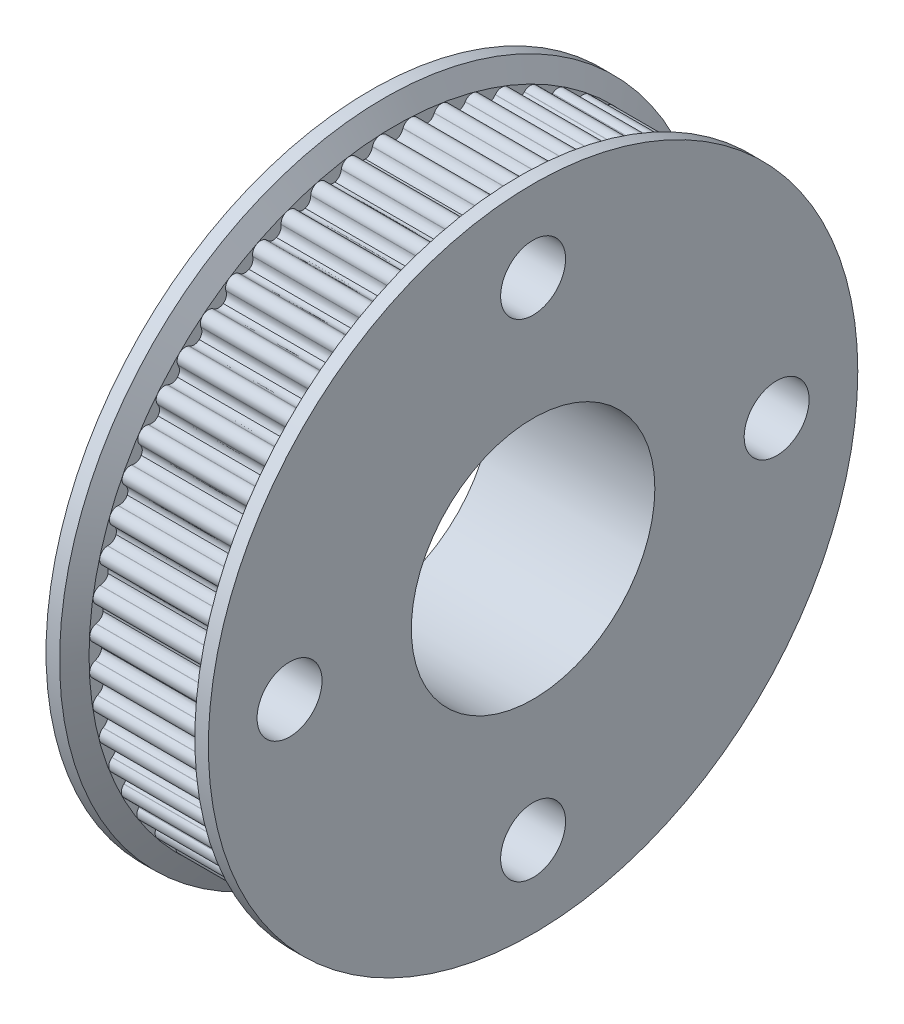
from build123d import *

# Parameters (mm, degrees)
SKETCH3_OUTSIDE_W  = 53.49
SKETCH3_OUTSIDE_H  = 53.49
CUT_EXTRUDE4_DEPTH = 7
SKETCH6_R          = 2
CUT_EXTRUDE5_DEPTH = 10
SKETCH7_R          = 3
CUT_EXTRUDE6_DEPTH = 3


with BuildPart() as part:
    # Sketch1 → Revolve1 (revolve)
    with BuildSketch(Plane(origin=(0, 0, 0), x_dir=(1, 0, 0), z_dir=(0, 1, 0))):
        Polygon((0, 7.5), (0, 8.95645673), (0, 20), (-0.83604719, 20), (-1.5, 18.85), (-8.5, 18.85), (-9.16395281, 20), (-10, 20), (-10, 7.5), align=None)
    revolve(axis=Axis((0, 0, 0), (-1, 0, 0)))

    # Sketch3 outside → Cut-Extrude4 (cut)
    with BuildSketch(Plane(origin=(-1.5, 0, 0), x_dir=(0, 0, -1), z_dir=(1, 0, 0))):
        Rectangle(SKETCH3_OUTSIDE_W, SKETCH3_OUTSIDE_H)
        with BuildLine():
            Line((0.48954913, 18.480375333), (0.485818632, 18.469717385))
            add(Edge.make_bspline(
                [(0.485818632, 18.469717385), (0.407741985, 18.249527558), (0.24028179, 18.086154527), (0.026214695, 18.085070307)],
                knots=[0, 0, 0, 0, 1, 1, 1, 1], degree=3))
            add(Edge.make_bspline(
                [(0.026214695, 18.085070307), (-0.187846082, 18.086775093), (-0.354832577, 18.250628249), (-0.432269829, 18.471041123)],
                knots=[0, 0, 0, 0, 1, 1, 1, 1], degree=3))
            Line((-0.432269829, 18.471041123), (-0.435971787, 18.481716895))
            ThreePointArc((-0.435971787, 18.481716895), (-0.931215069, 18.811965966), (-1.391421689, 18.434420969))
            Line((-1.391421689, 18.434420969), (-1.394049444, 18.423439012))
            add(Edge.make_bspline(
                [(-1.394049444, 18.423439012), (-1.451513615, 18.187532894), (-1.598236067, 18.015569009), (-1.838247448, 17.991333228)],
                knots=[0, 0, 0, 0, 1, 1, 1, 1], degree=3))
            add(Edge.make_bspline(
                [(-1.838247448, 17.991333228), (-2.078200755, 17.966529071), (-2.256668862, 18.105266918), (-2.36065454, 18.324677051)],
                knots=[0, 0, 0, 0, 1, 1, 1, 1], degree=3))
            Line((-2.36065454, 18.324677051), (-2.365448953, 18.334900655))
            ThreePointArc((-2.365448953, 18.334900655), (-2.892499669, 18.611573567), (-3.310721031, 18.187992111))
            Line((-3.310721031, 18.187992111), (-3.312186463, 18.176795639))
            add(Edge.make_bspline(
                [(-3.312186463, 18.176795639), (-3.344676936, 17.936175198), (-3.472620506, 17.749816677), (-3.70878375, 17.700625641)],
                knots=[0, 0, 0, 0, 1, 1, 1, 1], degree=3))
            add(Edge.make_bspline(
                [(-3.70878375, 17.700625641), (-3.944829828, 17.650875413), (-4.136822322, 17.770198244), (-4.26317296, 17.977536961)],
                knots=[0, 0, 0, 0, 1, 1, 1, 1], degree=3))
            Line((-4.26317296, 17.977536961), (-4.269009766, 17.987203407))
            ThreePointArc((-4.269009766, 17.987203407), (-4.822093437, 18.207268875), (-5.19374742, 17.742291806))
            Line((-5.19374742, 17.742291806), (-5.194034475, 17.73100349))
            add(Edge.make_bspline(
                [(-5.194034475, 17.73100349), (-5.201195276, 17.488305013), (-5.308958188, 17.289593639), (-5.538685842, 17.215986296)],
                knots=[0, 0, 0, 0, 1, 1, 1, 1], degree=3))
            add(Edge.make_bspline(
                [(-5.538685842, 17.215986296), (-5.76823852, 17.141835071), (-5.971651891, 17.240435558), (-6.118983164, 17.433431215)],
                knots=[0, 0, 0, 0, 1, 1, 1, 1], degree=3))
            Line((-6.118983164, 17.433431215), (-6.125798415, 17.442434594))
            ThreePointArc((-6.125798415, 17.442434594), (-6.698855341, 17.603481534), (-7.019870026, 17.102203239))
            Line((-7.019870026, 17.102203239), (-7.018975557, 17.090946756))
            add(Edge.make_bspline(
                [(-7.018975557, 17.090946756), (-7.000728232, 16.848829299), (-7.087129813, 16.639942195), (-7.307904933, 16.542725002)],
                knots=[0, 0, 0, 0, 1, 1, 1, 1], degree=3))
            add(Edge.make_bspline(
                [(-7.307904933, 16.542725002), (-7.528449183, 16.444985197), (-7.741054792, 16.521783053), (-7.907752509, 16.698321148)],
                knots=[0, 0, 0, 0, 1, 1, 1, 1], degree=3))
            Line((-7.907752509, 16.698321148), (-7.915471534, 16.706562818))
            ThreePointArc((-7.915471534, 16.706562818), (-8.502223183, 16.806826766), (-8.769081466, 16.274739354))
            Line((-8.769081466, 16.274739354), (-8.767015275, 16.263638033))
            add(Edge.make_bspline(
                [(-8.767015275, 16.263638033), (-8.723559745, 16.024754286), (-8.787653361, 15.807980062), (-8.997057087, 15.688218151)],
                knots=[0, 0, 0, 0, 1, 1, 1, 1], degree=3))
            add(Edge.make_bspline(
                [(-8.997057087, 15.688218151), (-9.206176582, 15.567960623), (-9.425645077, 15.622114435), (-9.609882862, 15.78026078)],
                knots=[0, 0, 0, 0, 1, 1, 1, 1], degree=3))
            Line((-9.609882862, 15.78026078), (-9.61842109, 15.787650443))
            ThreePointArc((-9.61842109, 15.787650443), (-10.212438889, 15.826032887), (-10.422217015, 15.268966019))
            Line((-10.422217015, 15.268966019), (-10.419001739, 15.258141488))
            add(Edge.make_bspline(
                [(-10.419001739, 15.258141488), (-10.350814112, 15.025108711), (-10.391897539, 14.802822392), (-10.587635602, 14.6618279)],
                knots=[0, 0, 0, 0, 1, 1, 1, 1], degree=3))
            add(Edge.make_bspline(
                [(-10.587635602, 14.6618279), (-10.783039184, 14.520370216), (-11.006966022, 14.551286663), (-11.206725327, 14.689308572)],
                knots=[0, 0, 0, 0, 1, 1, 1, 1], degree=3))
            Line((-11.206725327, 14.689308572), (-11.215989213, 14.695765267))
            ThreePointArc((-11.215989213, 14.695765267), (-11.810764978, 14.671845679), (-11.961164573, 14.095902697))
            Line((-11.961164573, 14.095902697), (-11.956835439, 14.085473551))
            add(Edge.make_bspline(
                [(-11.956835439, 14.085473551), (-11.864662793, 13.8608449), (-11.882285914, 13.635481902), (-12.062213765, 13.474799593)],
                knots=[0, 0, 0, 0, 1, 1, 1, 1], degree=3))
            add(Edge.make_bspline(
                [(-12.062213765, 13.474799593), (-12.241760551, 13.313691593), (-12.467692344, 13.321031948), (-12.680784565, 13.437417226)],
                knots=[0, 0, 0, 0, 1, 1, 1, 1], degree=3))
            Line((-12.680784565, 13.437417226), (-12.69067261, 13.442870211))
            ThreePointArc((-12.69067261, 13.442870211), (-13.279689854, 13.356910661), (-13.36906311, 12.768401715))
            Line((-13.36906311, 12.768401715), (-13.363667548, 12.75848222))
            add(Edge.make_bspline(
                [(-13.363667548, 12.75848222), (-13.248519746, 12.544718773), (-13.242489477, 12.318748218), (-13.404635791, 12.140138563)],
                knots=[0, 0, 0, 0, 1, 1, 1, 1], degree=3))
            add(Edge.make_bspline(
                [(-13.404635791, 12.140138563), (-13.566358629, 11.961145379), (-13.791820019, 11.94482922), (-14.015910473, 12.038302725)],
                knots=[0, 0, 0, 0, 1, 1, 1, 1], degree=3))
            Line((-14.015910473, 12.038302725), (-14.026314343, 12.042692255))
            ThreePointArc((-14.026314343, 12.042692255), (-14.603119668, 11.895634533), (-14.630487393, 11.301007453))
            Line((-14.630487393, 11.301007453), (-14.624084519, 11.291706287))
            add(Edge.make_bspline(
                [(-14.624084519, 11.291706287), (-14.487223144, 11.091150081), (-14.457605555, 10.867047752), (-14.600193821, 10.672467633)],
                knots=[0, 0, 0, 0, 1, 1, 1, 1], degree=3))
            add(Edge.make_bspline(
                [(-14.600193821, 10.672467633), (-14.742320842, 10.477550354), (-14.964841628, 10.437756444), (-15.197475133, 10.50729406)],
                knots=[0, 0, 0, 0, 1, 1, 1, 1], degree=3))
            Line((-15.197475133, 10.50729406), (-15.20828084, 10.510572043))
            ThreePointArc((-15.20828084, 10.510572043), (-15.766554648, 10.304027345), (-15.731616994, 9.709796987))
            Line((-15.731616994, 9.709796987), (-15.72427696, 9.701216057))
            add(Edge.make_bspline(
                [(-15.72427696, 9.701216057), (-15.567201494, 9.516064428), (-15.514321081, 9.296285636), (-15.635789073, 9.087866916)],
                knots=[0, 0, 0, 0, 1, 1, 1, 1], degree=3))
            add(Edge.make_bspline(
                [(-15.635789073, 9.087866916), (-15.756763103, 8.879161094), (-15.973905301, 8.816325423), (-16.212533075, 8.861165283)],
                knots=[0, 0, 0, 0, 1, 1, 1, 1], degree=3))
            Line((-16.212533075, 8.861165283), (-16.22362223, 8.863295805))
            ThreePointArc((-16.22362223, 8.863295805), (-16.757247956, 8.599527076), (-16.660387708, 8.012203954))
            Line((-16.660387708, 8.012203954), (-16.652190932, 8.004437273))
            add(Edge.make_bspline(
                [(-16.652190932, 8.004437273), (-16.476622326, 7.836718782), (-16.401058458, 7.623671469), (-16.500075347, 7.403697626)],
                knots=[0, 0, 0, 0, 1, 1, 1, 1], degree=3))
            add(Edge.make_bspline(
                [(-16.500075347, 7.403697626), (-16.598570971, 7.183489887), (-16.807955525, 7.098300897), (-17.049963113, 7.117951724)],
                knots=[0, 0, 0, 0, 1, 1, 1, 1], degree=3))
            Line((-17.049963113, 7.117951724), (-17.06121422, 7.118911443))
            ThreePointArc((-17.06121422, 7.118911443), (-17.564345349, 6.80080859), (-17.406623728, 6.226827538))
            Line((-17.406623728, 6.226827538), (-17.397660015, 6.2199602))
            add(Edge.make_bspline(
                [(-17.397660015, 6.2199602), (-17.205521836, 6.071512405), (-17.108102407, 5.867530763), (-17.183583343, 5.638411876)],
                knots=[0, 0, 0, 0, 1, 1, 1, 1], degree=3))
            add(Edge.make_bspline(
                [(-17.183583343, 5.638411876), (-17.258521421, 5.409114862), (-17.45785427, 5.3025059), (-17.700590186, 5.296752397)],
                knots=[0, 0, 0, 0, 1, 1, 1, 1], degree=3))
            Line((-17.700590186, 5.296752397), (-17.711879977, 5.296530797))
            ThreePointArc((-17.711879977, 5.296530797), (-18.179004098, 4.927579021), (-17.962149135, 4.373228696))
            Line((-17.962149135, 4.373228696), (-17.952516694, 4.367335942))
            add(Edge.make_bspline(
                [(-17.952516694, 4.367335942), (-17.745914049, 4.239785268), (-17.627706406, 4.047104161), (-17.678824405, 3.811350505)],
                knots=[0, 0, 0, 0, 1, 1, 1, 1], degree=3))
            add(Edge.make_bspline(
                [(-17.678824405, 3.811350505), (-17.729383899, 3.575476442), (-17.916481111, 3.448615539), (-18.157285889, 3.417520742)],
                knots=[0, 0, 0, 0, 1, 1, 1, 1], degree=3))
            Line((-18.157285889, 3.417520742), (-18.16849067, 3.416120252))
            ThreePointArc((-18.16849067, 3.416120252), (-18.594489874, 3.000361866), (-18.320877478, 2.471715846))
            Line((-18.320877478, 2.471715846), (-18.310681844, 2.466862237))
            add(Edge.make_bspline(
                [(-18.310681844, 2.466862237), (-18.091878313, 2.361606156), (-17.954177565, 2.18233664), (-17.980372566, 1.942531181)],
                knots=[0, 0, 0, 0, 1, 1, 1, 1], degree=3))
            add(Edge.make_bspline(
                [(-17.980372566, 1.942531181), (-18.005999537, 1.702664355), (-18.178811236, 1.556941425), (-18.415046569, 1.500846015)],
                knots=[0, 0, 0, 0, 1, 1, 1, 1], degree=3))
            Line((-18.415046569, 1.500846015), (-18.426043577, 1.498281978))
            ThreePointArc((-18.426043577, 1.498281978), (-18.806250528, 1.040272118), (-18.478878453, 0.543122359))
            Line((-18.478878453, 0.543122359), (-18.468231332, 0.539361073))
            add(Edge.make_bspline(
                [(-18.468231332, 0.539361073), (-18.239624173, 0.457552792), (-18.083938997, 0.293658981), (-18.084924003, 0.052429079)],
                knots=[0, 0, 0, 0, 1, 1, 1, 1], degree=3))
            add(Edge.make_bspline(
                [(-18.084924003, 0.052429079), (-18.085337676, -0.18880248), (-18.2419705, -0.351790866), (-18.471048144, -0.432272296)],
                knots=[0, 0, 0, 0, 1, 1, 1, 1], degree=3))
            Line((-18.471048144, -0.432272296), (-18.481716895, -0.435971787))
            ThreePointArc((-18.481716895, -0.435971787), (-18.811965966, -0.931215069), (-18.434420969, -1.391421689))
            Line((-18.434420969, -1.391421689), (-18.423439012, -1.394049444))
            add(Edge.make_bspline(
                [(-18.423439012, -1.394049444), (-18.187532894, -1.451513615), (-18.015569009, -1.598236067), (-17.991333228, -1.838247448)],
                knots=[0, 0, 0, 0, 1, 1, 1, 1], degree=3))
            add(Edge.make_bspline(
                [(-17.991333228, -1.838247448), (-17.966529071, -2.078200755), (-18.105266918, -2.256668862), (-18.324677051, -2.36065454)],
                knots=[0, 0, 0, 0, 1, 1, 1, 1], degree=3))
            Line((-18.324677051, -2.36065454), (-18.334900655, -2.365448953))
            ThreePointArc((-18.334900655, -2.365448953), (-18.611573568, -2.892499669), (-18.187992112, -3.310721031))
            Line((-18.187992112, -3.310721031), (-18.17679564, -3.312186463))
            add(Edge.make_bspline(
                [(-18.17679564, -3.312186463), (-17.936175198, -3.344676936), (-17.749816677, -3.472620506), (-17.700625641, -3.70878375)],
                knots=[0, 0, 0, 0, 1, 1, 1, 1], degree=3))
            add(Edge.make_bspline(
                [(-17.700625641, -3.70878375), (-17.650875413, -3.944829828), (-17.770198244, -4.136822322), (-17.977536961, -4.26317296)],
                knots=[0, 0, 0, 0, 1, 1, 1, 1], degree=3))
            Line((-17.977536961, -4.26317296), (-17.987203407, -4.269009766))
            ThreePointArc((-17.987203407, -4.269009766), (-18.207268875, -4.822093437), (-17.742291806, -5.19374742))
            Line((-17.742291806, -5.19374742), (-17.73100349, -5.194034475))
            add(Edge.make_bspline(
                [(-17.73100349, -5.194034475), (-17.488305014, -5.201195276), (-17.289593639, -5.308958188), (-17.215986296, -5.538685842)],
                knots=[0, 0, 0, 0, 1, 1, 1, 1], degree=3))
            add(Edge.make_bspline(
                [(-17.215986296, -5.538685842), (-17.141835071, -5.76823852), (-17.240435558, -5.971651891), (-17.433431215, -6.118983164)],
                knots=[0, 0, 0, 0, 1, 1, 1, 1], degree=3))
            Line((-17.433431215, -6.118983164), (-17.442434594, -6.125798415))
            ThreePointArc((-17.442434594, -6.125798415), (-17.603481534, -6.698855341), (-17.102203239, -7.019870026))
            Line((-17.102203239, -7.019870026), (-17.090946756, -7.018975557))
            add(Edge.make_bspline(
                [(-17.090946756, -7.018975557), (-16.848829299, -7.000728232), (-16.639942195, -7.087129813), (-16.542725002, -7.307904933)],
                knots=[0, 0, 0, 0, 1, 1, 1, 1], degree=3))
            add(Edge.make_bspline(
                [(-16.542725002, -7.307904933), (-16.444985197, -7.528449183), (-16.521783053, -7.741054792), (-16.698321148, -7.907752509)],
                knots=[0, 0, 0, 0, 1, 1, 1, 1], degree=3))
            Line((-16.698321148, -7.907752509), (-16.706562818, -7.915471534))
            ThreePointArc((-16.706562818, -7.915471534), (-16.806826766, -8.502223183), (-16.274739354, -8.769081466))
            Line((-16.274739354, -8.769081466), (-16.263638033, -8.767015275))
            add(Edge.make_bspline(
                [(-16.263638033, -8.767015275), (-16.024754286, -8.723559745), (-15.807980062, -8.787653361), (-15.688218151, -8.997057087)],
                knots=[0, 0, 0, 0, 1, 1, 1, 1], degree=3))
            add(Edge.make_bspline(
                [(-15.688218151, -8.997057087), (-15.567960623, -9.206176582), (-15.622114435, -9.425645077), (-15.78026078, -9.609882862)],
                knots=[0, 0, 0, 0, 1, 1, 1, 1], degree=3))
            Line((-15.78026078, -9.609882862), (-15.787650443, -9.61842109))
            ThreePointArc((-15.787650443, -9.61842109), (-15.826032887, -10.212438889), (-15.268966019, -10.422217015))
            Line((-15.268966019, -10.422217015), (-15.258141488, -10.419001739))
            add(Edge.make_bspline(
                [(-15.258141488, -10.419001739), (-15.025108711, -10.350814112), (-14.802822392, -10.391897539), (-14.6618279, -10.587635602)],
                knots=[0, 0, 0, 0, 1, 1, 1, 1], degree=3))
            add(Edge.make_bspline(
                [(-14.6618279, -10.587635602), (-14.520370216, -10.783039184), (-14.551286663, -11.006966022), (-14.689308572, -11.206725327)],
                knots=[0, 0, 0, 0, 1, 1, 1, 1], degree=3))
            Line((-14.689308572, -11.206725327), (-14.695765267, -11.215989213))
            ThreePointArc((-14.695765267, -11.215989213), (-14.671845679, -11.810764978), (-14.095902697, -11.961164573))
            Line((-14.095902697, -11.961164573), (-14.085473552, -11.956835439))
            add(Edge.make_bspline(
                [(-14.085473552, -11.956835439), (-13.8608449, -11.864662793), (-13.635481902, -11.882285914), (-13.474799593, -12.062213765)],
                knots=[0, 0, 0, 0, 1, 1, 1, 1], degree=3))
            add(Edge.make_bspline(
                [(-13.474799593, -12.062213765), (-13.313691593, -12.241760551), (-13.321031948, -12.467692344), (-13.437417226, -12.680784565)],
                knots=[0, 0, 0, 0, 1, 1, 1, 1], degree=3))
            Line((-13.437417226, -12.680784565), (-13.442870211, -12.69067261))
            ThreePointArc((-13.442870211, -12.69067261), (-13.356910661, -13.279689854), (-12.768401715, -13.36906311))
            Line((-12.768401715, -13.36906311), (-12.75848222, -13.363667548))
            add(Edge.make_bspline(
                [(-12.75848222, -13.363667548), (-12.544718773, -13.248519746), (-12.318748218, -13.242489477), (-12.140138563, -13.404635791)],
                knots=[0, 0, 0, 0, 1, 1, 1, 1], degree=3))
            add(Edge.make_bspline(
                [(-12.140138563, -13.404635791), (-11.961145379, -13.566358629), (-11.94482922, -13.791820019), (-12.038302725, -14.015910473)],
                knots=[0, 0, 0, 0, 1, 1, 1, 1], degree=3))
            Line((-12.038302725, -14.015910473), (-12.042692255, -14.026314343))
            ThreePointArc((-12.042692255, -14.026314343), (-11.895634533, -14.603119668), (-11.301007453, -14.630487393))
            Line((-11.301007453, -14.630487393), (-11.291706287, -14.624084519))
            add(Edge.make_bspline(
                [(-11.291706287, -14.624084519), (-11.091150081, -14.487223144), (-10.867047752, -14.457605555), (-10.672467633, -14.600193821)],
                knots=[0, 0, 0, 0, 1, 1, 1, 1], degree=3))
            add(Edge.make_bspline(
                [(-10.672467633, -14.600193821), (-10.477550354, -14.742320842), (-10.437756444, -14.964841628), (-10.50729406, -15.197475133)],
                knots=[0, 0, 0, 0, 1, 1, 1, 1], degree=3))
            Line((-10.50729406, -15.197475133), (-10.510572044, -15.20828084))
            ThreePointArc((-10.510572044, -15.20828084), (-10.304027345, -15.766554648), (-9.709796987, -15.731616994))
            Line((-9.709796987, -15.731616994), (-9.701216057, -15.72427696))
            add(Edge.make_bspline(
                [(-9.701216057, -15.72427696), (-9.516064428, -15.567201494), (-9.296285636, -15.514321081), (-9.087866916, -15.635789073)],
                knots=[0, 0, 0, 0, 1, 1, 1, 1], degree=3))
            add(Edge.make_bspline(
                [(-9.087866916, -15.635789073), (-8.879161094, -15.756763103), (-8.816325423, -15.973905301), (-8.861165283, -16.212533075)],
                knots=[0, 0, 0, 0, 1, 1, 1, 1], degree=3))
            Line((-8.861165283, -16.212533075), (-8.863295805, -16.22362223))
            ThreePointArc((-8.863295805, -16.22362223), (-8.599527076, -16.757247956), (-8.012203954, -16.660387708))
            Line((-8.012203954, -16.660387708), (-8.004437273, -16.652190932))
            add(Edge.make_bspline(
                [(-8.004437273, -16.652190932), (-7.836718782, -16.476622326), (-7.623671469, -16.401058458), (-7.403697626, -16.500075347)],
                knots=[0, 0, 0, 0, 1, 1, 1, 1], degree=3))
            add(Edge.make_bspline(
                [(-7.403697626, -16.500075347), (-7.183489887, -16.598570971), (-7.098300897, -16.807955525), (-7.117951724, -17.049963113)],
                knots=[0, 0, 0, 0, 1, 1, 1, 1], degree=3))
            Line((-7.117951724, -17.049963113), (-7.118911443, -17.06121422))
            ThreePointArc((-7.118911443, -17.06121422), (-6.80080859, -17.564345349), (-6.226827538, -17.406623728))
            Line((-6.226827538, -17.406623728), (-6.2199602, -17.397660015))
            add(Edge.make_bspline(
                [(-6.2199602, -17.397660015), (-6.071512405, -17.205521836), (-5.867530763, -17.108102407), (-5.638411876, -17.183583343)],
                knots=[0, 0, 0, 0, 1, 1, 1, 1], degree=3))
            add(Edge.make_bspline(
                [(-5.638411876, -17.183583343), (-5.409114862, -17.258521421), (-5.3025059, -17.45785427), (-5.296752397, -17.700590186)],
                knots=[0, 0, 0, 0, 1, 1, 1, 1], degree=3))
            Line((-5.296752397, -17.700590186), (-5.296530797, -17.711879977))
            ThreePointArc((-5.296530797, -17.711879977), (-4.927579021, -18.179004098), (-4.373228696, -17.962149135))
            Line((-4.373228696, -17.962149135), (-4.367335942, -17.952516694))
            add(Edge.make_bspline(
                [(-4.367335942, -17.952516694), (-4.239785268, -17.745914049), (-4.047104161, -17.627706406), (-3.811350505, -17.678824405)],
                knots=[0, 0, 0, 0, 1, 1, 1, 1], degree=3))
            add(Edge.make_bspline(
                [(-3.811350505, -17.678824405), (-3.575476442, -17.729383899), (-3.448615539, -17.916481111), (-3.417520742, -18.157285889)],
                knots=[0, 0, 0, 0, 1, 1, 1, 1], degree=3))
            Line((-3.417520742, -18.157285889), (-3.416120252, -18.16849067))
            ThreePointArc((-3.416120252, -18.16849067), (-3.000361866, -18.594489874), (-2.471715846, -18.320877478))
            Line((-2.471715846, -18.320877478), (-2.466862237, -18.310681844))
            add(Edge.make_bspline(
                [(-2.466862237, -18.310681844), (-2.361606156, -18.091878314), (-2.18233664, -17.954177565), (-1.942531181, -17.980372566)],
                knots=[0, 0, 0, 0, 1, 1, 1, 1], degree=3))
            add(Edge.make_bspline(
                [(-1.942531181, -17.980372566), (-1.702664355, -18.005999537), (-1.556941425, -18.178811236), (-1.500846015, -18.415046569)],
                knots=[0, 0, 0, 0, 1, 1, 1, 1], degree=3))
            Line((-1.500846015, -18.415046569), (-1.498281978, -18.426043577))
            ThreePointArc((-1.498281978, -18.426043577), (-1.040272118, -18.806250528), (-0.543122359, -18.478878453))
            Line((-0.543122359, -18.478878453), (-0.539361073, -18.468231332))
            add(Edge.make_bspline(
                [(-0.539361073, -18.468231332), (-0.457552792, -18.239624173), (-0.293658981, -18.083938997), (-0.052429079, -18.084924003)],
                knots=[0, 0, 0, 0, 1, 1, 1, 1], degree=3))
            add(Edge.make_bspline(
                [(-0.052429079, -18.084924003), (0.18880248, -18.085337676), (0.351790866, -18.2419705), (0.432272296, -18.471048144)],
                knots=[0, 0, 0, 0, 1, 1, 1, 1], degree=3))
            Line((0.432272296, -18.471048144), (0.435971787, -18.481716895))
            ThreePointArc((0.435971787, -18.481716895), (0.931215069, -18.811965966), (1.391421689, -18.434420969))
            Line((1.391421689, -18.434420969), (1.39404954, -18.423439036))
            add(Edge.make_bspline(
                [(1.39404954, -18.423439036), (1.451513615, -18.187532894), (1.598236067, -18.015569009), (1.838247448, -17.991333228)],
                knots=[0, 0, 0, 0, 1, 1, 1, 1], degree=3))
            add(Edge.make_bspline(
                [(1.838247448, -17.991333228), (2.078200755, -17.966529071), (2.256668862, -18.105266919), (2.36065454, -18.324677051)],
                knots=[0, 0, 0, 0, 1, 1, 1, 1], degree=3))
            Line((2.36065454, -18.324677051), (2.365448953, -18.334900655))
            ThreePointArc((2.365448953, -18.334900655), (2.892499669, -18.611573568), (3.310721031, -18.187992112))
            Line((3.310721031, -18.187992112), (3.312186562, -18.176795653))
            add(Edge.make_bspline(
                [(3.312186562, -18.176795653), (3.344676936, -17.936175198), (3.472620506, -17.749816677), (3.70878375, -17.700625641)],
                knots=[0, 0, 0, 0, 1, 1, 1, 1], degree=3))
            add(Edge.make_bspline(
                [(3.70878375, -17.700625641), (3.944829828, -17.650875413), (4.136822322, -17.770198244), (4.26317296, -17.977536961)],
                knots=[0, 0, 0, 0, 1, 1, 1, 1], degree=3))
            Line((4.26317296, -17.977536961), (4.269009766, -17.987203407))
            ThreePointArc((4.269009766, -17.987203407), (4.822093437, -18.207268875), (5.19374742, -17.742291806))
            Line((5.19374742, -17.742291806), (5.194034574, -17.731003493))
            add(Edge.make_bspline(
                [(5.194034574, -17.731003493), (5.201195276, -17.488305014), (5.308958188, -17.289593639), (5.538685842, -17.215986296)],
                knots=[0, 0, 0, 0, 1, 1, 1, 1], degree=3))
            add(Edge.make_bspline(
                [(5.538685842, -17.215986296), (5.76823852, -17.141835071), (5.971651891, -17.240435558), (6.118983164, -17.433431215)],
                knots=[0, 0, 0, 0, 1, 1, 1, 1], degree=3))
            Line((6.118983164, -17.433431215), (6.125798414, -17.442434594))
            ThreePointArc((6.125798414, -17.442434594), (6.698855341, -17.603481534), (7.019870025, -17.102203239))
            Line((7.019870025, -17.102203239), (7.018975656, -17.090946748))
            add(Edge.make_bspline(
                [(7.018975656, -17.090946748), (7.000728232, -16.848829299), (7.087129813, -16.639942195), (7.307904932, -16.542725002)],
                knots=[0, 0, 0, 0, 1, 1, 1, 1], degree=3))
            add(Edge.make_bspline(
                [(7.307904932, -16.542725002), (7.528449183, -16.444985197), (7.741054792, -16.521783053), (7.907752509, -16.698321148)],
                knots=[0, 0, 0, 0, 1, 1, 1, 1], degree=3))
            Line((7.907752509, -16.698321148), (7.915471534, -16.706562818))
            ThreePointArc((7.915471534, -16.706562818), (8.502223183, -16.806826766), (8.769081466, -16.274739354))
            Line((8.769081466, -16.274739354), (8.767015373, -16.263638015))
            add(Edge.make_bspline(
                [(8.767015373, -16.263638015), (8.723559745, -16.024754286), (8.787653361, -15.807980062), (8.997057087, -15.688218151)],
                knots=[0, 0, 0, 0, 1, 1, 1, 1], degree=3))
            add(Edge.make_bspline(
                [(8.997057087, -15.688218151), (9.206176582, -15.567960623), (9.425645077, -15.622114435), (9.609882862, -15.78026078)],
                knots=[0, 0, 0, 0, 1, 1, 1, 1], degree=3))
            Line((9.609882862, -15.78026078), (9.61842109, -15.787650443))
            ThreePointArc((9.61842109, -15.787650443), (10.212438889, -15.826032887), (10.422217015, -15.268966019))
            Line((10.422217015, -15.268966019), (10.419001834, -15.25814146))
            add(Edge.make_bspline(
                [(10.419001834, -15.25814146), (10.350814112, -15.025108711), (10.391897539, -14.802822392), (10.587635602, -14.6618279)],
                knots=[0, 0, 0, 0, 1, 1, 1, 1], degree=3))
            add(Edge.make_bspline(
                [(10.587635602, -14.6618279), (10.783039184, -14.520370216), (11.006966022, -14.551286663), (11.206725327, -14.689308572)],
                knots=[0, 0, 0, 0, 1, 1, 1, 1], degree=3))
            Line((11.206725327, -14.689308572), (11.215989213, -14.695765267))
            ThreePointArc((11.215989213, -14.695765267), (11.810764978, -14.671845679), (11.961164573, -14.095902697))
            Line((11.961164573, -14.095902697), (11.956835531, -14.085473514))
            add(Edge.make_bspline(
                [(11.956835531, -14.085473514), (11.864662793, -13.8608449), (11.882285914, -13.635481902), (12.062213765, -13.474799593)],
                knots=[0, 0, 0, 0, 1, 1, 1, 1], degree=3))
            add(Edge.make_bspline(
                [(12.062213765, -13.474799593), (12.241760551, -13.313691593), (12.467692344, -13.321031948), (12.680784565, -13.437417226)],
                knots=[0, 0, 0, 0, 1, 1, 1, 1], degree=3))
            Line((12.680784565, -13.437417226), (12.69067261, -13.442870211))
            ThreePointArc((12.69067261, -13.442870211), (13.279689854, -13.356910661), (13.36906311, -12.768401715))
            Line((13.36906311, -12.768401715), (13.363667635, -12.758482173))
            add(Edge.make_bspline(
                [(13.363667635, -12.758482173), (13.248519746, -12.544718773), (13.242489477, -12.318748218), (13.404635791, -12.140138563)],
                knots=[0, 0, 0, 0, 1, 1, 1, 1], degree=3))
            add(Edge.make_bspline(
                [(13.404635791, -12.140138563), (13.566358629, -11.961145379), (13.791820019, -11.94482922), (14.015910473, -12.038302725)],
                knots=[0, 0, 0, 0, 1, 1, 1, 1], degree=3))
            Line((14.015910473, -12.038302725), (14.026314343, -12.042692255))
            ThreePointArc((14.026314343, -12.042692255), (14.603119668, -11.895634533), (14.630487393, -11.301007453))
            Line((14.630487393, -11.301007453), (14.624084601, -11.291706231))
            add(Edge.make_bspline(
                [(14.624084601, -11.291706231), (14.487223144, -11.091150081), (14.457605555, -10.867047752), (14.600193821, -10.672467633)],
                knots=[0, 0, 0, 0, 1, 1, 1, 1], degree=3))
            add(Edge.make_bspline(
                [(14.600193821, -10.672467633), (14.742320842, -10.477550354), (14.964841628, -10.437756444), (15.197475133, -10.50729406)],
                knots=[0, 0, 0, 0, 1, 1, 1, 1], degree=3))
            Line((15.197475133, -10.50729406), (15.20828084, -10.510572044))
            ThreePointArc((15.20828084, -10.510572044), (15.766554648, -10.304027345), (15.731616994, -9.709796987))
            Line((15.731616994, -9.709796987), (15.724277035, -9.701215992))
            add(Edge.make_bspline(
                [(15.724277035, -9.701215992), (15.567201493, -9.516064428), (15.514321081, -9.296285636), (15.635789073, -9.087866916)],
                knots=[0, 0, 0, 0, 1, 1, 1, 1], degree=3))
            add(Edge.make_bspline(
                [(15.635789073, -9.087866916), (15.756763103, -8.879161094), (15.973905301, -8.816325423), (16.212533075, -8.861165283)],
                knots=[0, 0, 0, 0, 1, 1, 1, 1], degree=3))
            Line((16.212533075, -8.861165283), (16.22362223, -8.863295805))
            ThreePointArc((16.22362223, -8.863295805), (16.757247956, -8.599527077), (16.660387708, -8.012203954))
            Line((16.660387708, -8.012203954), (16.652191, -8.004437202))
            add(Edge.make_bspline(
                [(16.652191, -8.004437202), (16.476622326, -7.836718782), (16.401058458, -7.623671469), (16.500075347, -7.403697626)],
                knots=[0, 0, 0, 0, 1, 1, 1, 1], degree=3))
            add(Edge.make_bspline(
                [(16.500075347, -7.403697626), (16.598570971, -7.183489887), (16.807955525, -7.098300897), (17.049963113, -7.117951724)],
                knots=[0, 0, 0, 0, 1, 1, 1, 1], degree=3))
            Line((17.049963113, -7.117951724), (17.06121422, -7.118911443))
            ThreePointArc((17.06121422, -7.118911443), (17.564345349, -6.80080859), (17.406623728, -6.226827538))
            Line((17.406623728, -6.226827538), (17.397660075, -6.219960122))
            add(Edge.make_bspline(
                [(17.397660075, -6.219960122), (17.205521836, -6.071512405), (17.108102407, -5.867530763), (17.183583343, -5.638411876)],
                knots=[0, 0, 0, 0, 1, 1, 1, 1], degree=3))
            add(Edge.make_bspline(
                [(17.183583343, -5.638411876), (17.258521421, -5.409114862), (17.45785427, -5.3025059), (17.700590186, -5.296752397)],
                knots=[0, 0, 0, 0, 1, 1, 1, 1], degree=3))
            Line((17.700590186, -5.296752397), (17.711879977, -5.296530797))
            ThreePointArc((17.711879977, -5.296530797), (18.179004098, -4.927579021), (17.962149135, -4.373228696))
            Line((17.962149135, -4.373228696), (17.952516746, -4.367335857))
            add(Edge.make_bspline(
                [(17.952516746, -4.367335857), (17.745914049, -4.239785268), (17.627706406, -4.047104161), (17.678824404, -3.811350505)],
                knots=[0, 0, 0, 0, 1, 1, 1, 1], degree=3))
            add(Edge.make_bspline(
                [(17.678824404, -3.811350505), (17.729383899, -3.575476442), (17.916481111, -3.448615539), (18.157285889, -3.417520742)],
                knots=[0, 0, 0, 0, 1, 1, 1, 1], degree=3))
            Line((18.157285889, -3.417520742), (18.16849067, -3.416120252))
            ThreePointArc((18.16849067, -3.416120252), (18.594489874, -3.000361866), (18.320877478, -2.471715846))
            Line((18.320877478, -2.471715846), (18.310681887, -2.466862147))
            add(Edge.make_bspline(
                [(18.310681887, -2.466862147), (18.091878313, -2.361606156), (17.954177565, -2.18233664), (17.980372566, -1.942531181)],
                knots=[0, 0, 0, 0, 1, 1, 1, 1], degree=3))
            add(Edge.make_bspline(
                [(17.980372566, -1.942531181), (18.005999537, -1.702664355), (18.178811236, -1.556941425), (18.415046569, -1.500846015)],
                knots=[0, 0, 0, 0, 1, 1, 1, 1], degree=3))
            Line((18.415046569, -1.500846015), (18.426043577, -1.498281978))
            ThreePointArc((18.426043577, -1.498281978), (18.806250528, -1.040272118), (18.478878453, -0.543122359))
            Line((18.478878453, -0.543122359), (18.468231365, -0.539360979))
            add(Edge.make_bspline(
                [(18.468231365, -0.539360979), (18.239624173, -0.457552792), (18.083938997, -0.293658981), (18.084924003, -0.052429079)],
                knots=[0, 0, 0, 0, 1, 1, 1, 1], degree=3))
            add(Edge.make_bspline(
                [(18.084924003, -0.052429079), (18.085337676, 0.18880248), (18.2419705, 0.351790866), (18.471048144, 0.432272296)],
                knots=[0, 0, 0, 0, 1, 1, 1, 1], degree=3))
            Line((18.471048144, 0.432272296), (18.481716895, 0.435971787))
            ThreePointArc((18.481716895, 0.435971787), (18.811965966, 0.931215069), (18.434420969, 1.391421689))
            Line((18.434420969, 1.391421689), (18.423439036, 1.39404954))
            add(Edge.make_bspline(
                [(18.423439036, 1.39404954), (18.187532894, 1.451513615), (18.015569009, 1.598236067), (17.991333228, 1.838247448)],
                knots=[0, 0, 0, 0, 1, 1, 1, 1], degree=3))
            add(Edge.make_bspline(
                [(17.991333228, 1.838247448), (17.966529071, 2.078200755), (18.105266919, 2.256668862), (18.324677051, 2.36065454)],
                knots=[0, 0, 0, 0, 1, 1, 1, 1], degree=3))
            Line((18.324677051, 2.36065454), (18.334900655, 2.365448953))
            ThreePointArc((18.334900655, 2.365448953), (18.611573568, 2.892499669), (18.187992112, 3.310721031))
            Line((18.187992112, 3.310721031), (18.176795653, 3.312186562))
            add(Edge.make_bspline(
                [(18.176795653, 3.312186562), (17.936175198, 3.344676936), (17.749816677, 3.472620506), (17.700625641, 3.70878375)],
                knots=[0, 0, 0, 0, 1, 1, 1, 1], degree=3))
            add(Edge.make_bspline(
                [(17.700625641, 3.70878375), (17.650875413, 3.944829828), (17.770198244, 4.136822322), (17.977536961, 4.26317296)],
                knots=[0, 0, 0, 0, 1, 1, 1, 1], degree=3))
            Line((17.977536961, 4.26317296), (17.987203407, 4.269009766))
            ThreePointArc((17.987203407, 4.269009766), (18.207268875, 4.822093437), (17.742291806, 5.19374742))
            Line((17.742291806, 5.19374742), (17.731003493, 5.194034574))
            add(Edge.make_bspline(
                [(17.731003493, 5.194034574), (17.488305013, 5.201195276), (17.289593639, 5.308958188), (17.215986296, 5.538685842)],
                knots=[0, 0, 0, 0, 1, 1, 1, 1], degree=3))
            add(Edge.make_bspline(
                [(17.215986296, 5.538685842), (17.141835071, 5.76823852), (17.240435558, 5.971651891), (17.433431215, 6.118983164)],
                knots=[0, 0, 0, 0, 1, 1, 1, 1], degree=3))
            Line((17.433431215, 6.118983164), (17.442434594, 6.125798414))
            ThreePointArc((17.442434594, 6.125798414), (17.603481534, 6.698855341), (17.102203239, 7.019870025))
            Line((17.102203239, 7.019870025), (17.090946748, 7.018975656))
            add(Edge.make_bspline(
                [(17.090946748, 7.018975656), (16.848829299, 7.000728232), (16.639942195, 7.087129813), (16.542725002, 7.307904932)],
                knots=[0, 0, 0, 0, 1, 1, 1, 1], degree=3))
            add(Edge.make_bspline(
                [(16.542725002, 7.307904932), (16.444985197, 7.528449183), (16.521783053, 7.741054792), (16.698321148, 7.907752509)],
                knots=[0, 0, 0, 0, 1, 1, 1, 1], degree=3))
            Line((16.698321148, 7.907752509), (16.706562818, 7.915471534))
            ThreePointArc((16.706562818, 7.915471534), (16.806826766, 8.502223183), (16.274739354, 8.769081466))
            Line((16.274739354, 8.769081466), (16.263638015, 8.767015373))
            add(Edge.make_bspline(
                [(16.263638015, 8.767015373), (16.024754286, 8.723559745), (15.807980062, 8.787653361), (15.688218151, 8.997057087)],
                knots=[0, 0, 0, 0, 1, 1, 1, 1], degree=3))
            add(Edge.make_bspline(
                [(15.688218151, 8.997057087), (15.567960623, 9.206176582), (15.622114435, 9.425645077), (15.78026078, 9.609882862)],
                knots=[0, 0, 0, 0, 1, 1, 1, 1], degree=3))
            Line((15.78026078, 9.609882862), (15.787650443, 9.61842109))
            ThreePointArc((15.787650443, 9.61842109), (15.826032887, 10.212438889), (15.268966019, 10.422217015))
            Line((15.268966019, 10.422217015), (15.25814146, 10.419001834))
            add(Edge.make_bspline(
                [(15.25814146, 10.419001834), (15.025108711, 10.350814112), (14.802822392, 10.391897539), (14.6618279, 10.587635602)],
                knots=[0, 0, 0, 0, 1, 1, 1, 1], degree=3))
            add(Edge.make_bspline(
                [(14.6618279, 10.587635602), (14.520370216, 10.783039184), (14.551286663, 11.006966022), (14.689308572, 11.206725327)],
                knots=[0, 0, 0, 0, 1, 1, 1, 1], degree=3))
            Line((14.689308572, 11.206725327), (14.695765267, 11.215989213))
            ThreePointArc((14.695765267, 11.215989213), (14.671845679, 11.810764978), (14.095902697, 11.961164573))
            Line((14.095902697, 11.961164573), (14.085473514, 11.956835531))
            add(Edge.make_bspline(
                [(14.085473514, 11.956835531), (13.8608449, 11.864662793), (13.635481902, 11.882285914), (13.474799593, 12.062213765)],
                knots=[0, 0, 0, 0, 1, 1, 1, 1], degree=3))
            add(Edge.make_bspline(
                [(13.474799593, 12.062213765), (13.313691593, 12.241760551), (13.321031948, 12.467692344), (13.437417226, 12.680784565)],
                knots=[0, 0, 0, 0, 1, 1, 1, 1], degree=3))
            Line((13.437417226, 12.680784565), (13.442870211, 12.69067261))
            ThreePointArc((13.442870211, 12.69067261), (13.356910661, 13.279689854), (12.768401715, 13.36906311))
            Line((12.768401715, 13.36906311), (12.758482172, 13.363667635))
            add(Edge.make_bspline(
                [(12.758482172, 13.363667635), (12.544718773, 13.248519746), (12.318748218, 13.242489477), (12.140138563, 13.404635791)],
                knots=[0, 0, 0, 0, 1, 1, 1, 1], degree=3))
            add(Edge.make_bspline(
                [(12.140138563, 13.404635791), (11.961145379, 13.566358629), (11.94482922, 13.791820019), (12.038302725, 14.015910473)],
                knots=[0, 0, 0, 0, 1, 1, 1, 1], degree=3))
            Line((12.038302725, 14.015910473), (12.042692255, 14.026314343))
            ThreePointArc((12.042692255, 14.026314343), (11.895634533, 14.603119668), (11.301007453, 14.630487393))
            Line((11.301007453, 14.630487393), (11.291706231, 14.624084601))
            add(Edge.make_bspline(
                [(11.291706231, 14.624084601), (11.091150081, 14.487223144), (10.867047752, 14.457605555), (10.672467633, 14.600193821)],
                knots=[0, 0, 0, 0, 1, 1, 1, 1], degree=3))
            add(Edge.make_bspline(
                [(10.672467633, 14.600193821), (10.477550354, 14.742320842), (10.437756444, 14.964841628), (10.50729406, 15.197475133)],
                knots=[0, 0, 0, 0, 1, 1, 1, 1], degree=3))
            Line((10.50729406, 15.197475133), (10.510572043, 15.20828084))
            ThreePointArc((10.510572043, 15.20828084), (10.304027345, 15.766554648), (9.709796987, 15.731616994))
            Line((9.709796987, 15.731616994), (9.701215992, 15.724277035))
            add(Edge.make_bspline(
                [(9.701215992, 15.724277035), (9.516064428, 15.567201493), (9.599334459, 15.33876957), (9.0425, 15.662069427)],
                knots=[0, 0, 0, 0, 1, 1, 1, 1], degree=3))
            add(Edge.make_bspline(
                [(9.0425, 15.662069427), (8.833444347, 15.782437904), (8.769979438, 15.999397026), (8.814127318, 16.23815379)],
                knots=[0, 0, 0, 0, 1, 1, 1, 1], degree=3))
            Line((8.814127318, 16.23815379), (8.816225683, 16.249249075))
            ThreePointArc((8.816225683, 16.249249075), (8.550911063, 16.782107883), (7.96387121, 16.683545371))
            Line((7.96387121, 16.683545371), (7.956128252, 16.675326181))
            add(Edge.make_bspline(
                [(7.956128252, 16.675326181), (7.788919518, 16.499272023), (7.576092163, 16.423090841), (7.35583219, 16.521469601)],
                knots=[0, 0, 0, 0, 1, 1, 1, 1], degree=3))
            add(Edge.make_bspline(
                [(7.35583219, 16.521469601), (7.135339834, 16.619326421), (7.049544188, 16.828463129), (7.068493344, 17.070526668)],
                knots=[0, 0, 0, 0, 1, 1, 1, 1], degree=3))
            Line((7.068493344, 17.070526668), (7.069420441, 17.081780511))
            ThreePointArc((7.069420441, 17.081780511), (6.74986033, 17.583987333), (6.176338931, 17.424602383))
            Line((6.176338931, 17.424602383), (6.169497529, 17.415618859))
            add(Edge.make_bspline(
                [(6.169497529, 17.415618859), (6.021607452, 17.223051072), (5.817909089, 17.125040702), (5.588572343, 17.199857097)],
                knots=[0, 0, 0, 0, 1, 1, 1, 1], degree=3))
            add(Edge.make_bspline(
                [(5.588572343, 17.199857097), (5.359059045, 17.274130119), (5.251872657, 17.473153068), (5.245415478, 17.715871284)],
                knots=[0, 0, 0, 0, 1, 1, 1, 1], degree=3))
            Line((5.245415478, 17.715871284), (5.24516115, 17.727160385))
            ThreePointArc((5.24516115, 17.727160385), (4.874856715, 18.193212938), (4.32113739, 17.974751805))
            Line((4.32113739, 17.974751805), (4.3152725, 17.965102373))
            add(Edge.make_bspline(
                [(4.3152725, 17.965102373), (4.188321395, 17.75813077), (3.995983787, 17.639365034), (3.760082928, 17.689799359)],
                knots=[0, 0, 0, 0, 1, 1, 1, 1], degree=3))
            add(Edge.make_bspline(
                [(3.760082928, 17.689799359), (3.524063283, 17.739674834), (3.396660511, 17.926403485), (3.364867742, 18.167117106)],
                knots=[0, 0, 0, 0, 1, 1, 1, 1], degree=3))
            Line((3.364867742, 18.167117106), (3.363434775, 18.17831778))
            ThreePointArc((3.363434775, 18.17831778), (2.946443149, 18.603109895), (2.418592563, 18.327966085))
            Line((2.418592563, 18.327966085), (2.413768442, 18.317756465))
            add(Edge.make_bspline(
                [(2.413768442, 18.317756465), (2.309147212, 18.09864867), (2.130277649, 17.960428791), (1.890397258, 17.985928478)],
                knots=[0, 0, 0, 0, 1, 1, 1, 1], degree=3))
            add(Edge.make_bspline(
                [(1.890397258, 17.985928478), (1.650457146, 18.010859958), (1.504233841, 18.183248475), (1.447453812, 18.419320192)],
                knots=[0, 0, 0, 0, 1, 1, 1, 1], degree=3))
            Line((1.447453812, 18.419320192), (1.444857905, 18.430309721))
            ThreePointArc((1.444857905, 18.430309721), (0.985747736, 18.809187287), (0.48954913, 18.480375333))
        make_face(mode=Mode.SUBTRACT)
    extrude(amount=-CUT_EXTRUDE4_DEPTH, mode=Mode.SUBTRACT)

    # Sketch6 → Cut-Extrude5 (cut)
    with BuildSketch(Plane.ZY.offset(10)):
        with Locations((0, 15)):
            Circle(SKETCH6_R)
        with Locations((15, 0)):
            Circle(SKETCH6_R)
        with Locations((0, -15)):
            Circle(SKETCH6_R)
        with Locations((-15, 0)):
            Circle(SKETCH6_R)
    extrude(amount=-CUT_EXTRUDE5_DEPTH, mode=Mode.SUBTRACT)

    # Sketch7 → Cut-Extrude6 (cut)
    with BuildSketch(Plane.ZY.offset(10)):
        with Locations((0, 15)):
            Circle(SKETCH7_R)
        with Locations((15, 0)):
            Circle(SKETCH7_R)
        with Locations((0, -15)):
            Circle(SKETCH7_R)
        with Locations((-15, 0)):
            Circle(SKETCH7_R)
    extrude(amount=-CUT_EXTRUDE6_DEPTH, mode=Mode.SUBTRACT)


solid = part.part
